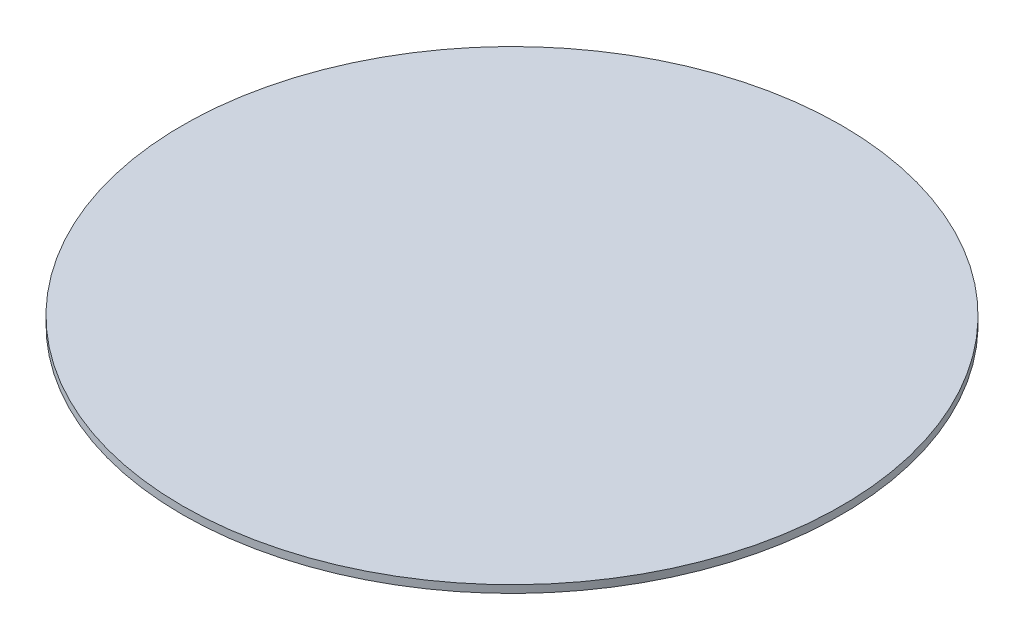
from build123d import *

# Parameters (mm, degrees)
SKETCH_1_R        = 130
EXTRUDE_221_DEPTH = 3


with BuildPart() as part:
    # Эскиз1 → Extrude 221 (new body)
    with BuildSketch(Plane(origin=(0, 0, 0), x_dir=(1, 0, 0), z_dir=(0, 1, 0))):
        with Locations(Location((0, 0, 0), (0, 0, 270))):
            Circle(SKETCH_1_R)
    extrude(amount=EXTRUDE_221_DEPTH)


solid = part.part
